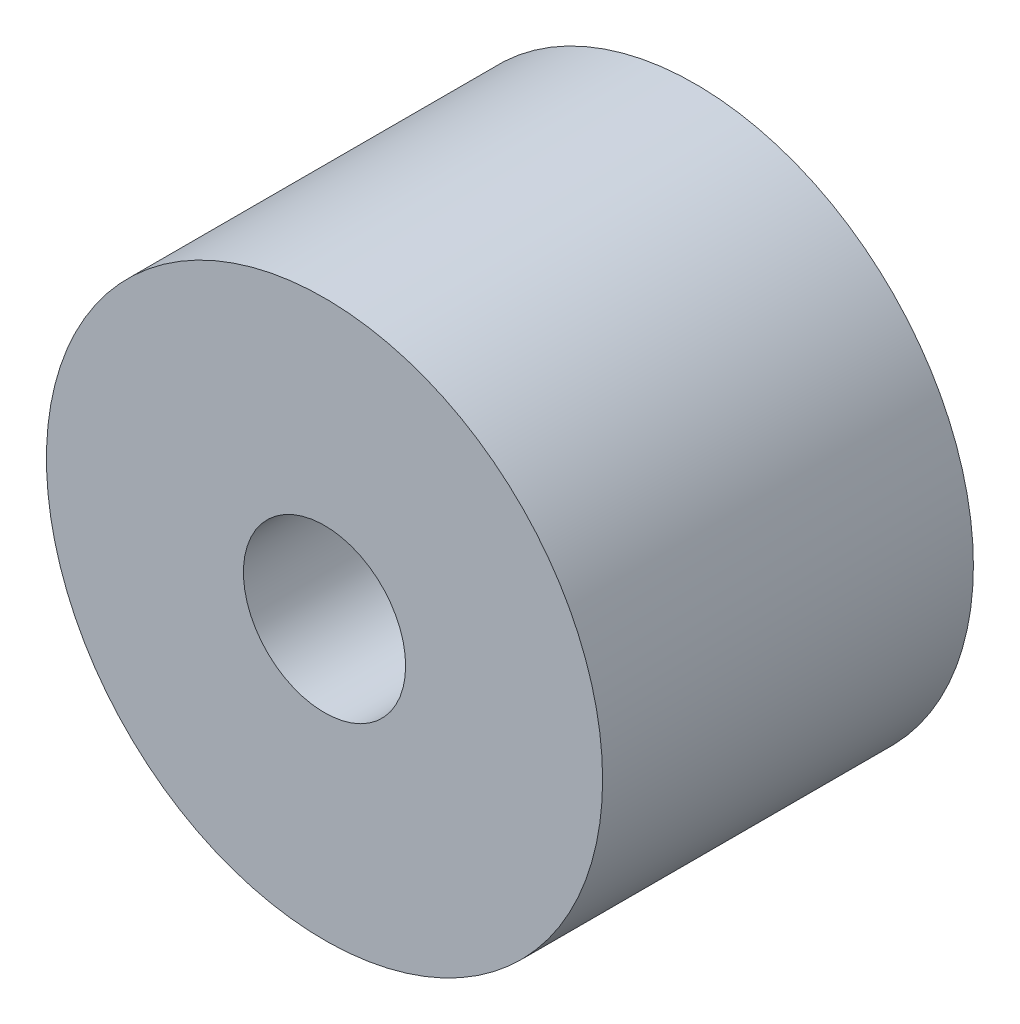
from build123d import *

# Parameters (mm, degrees)
CROQUIS1_R              = 19.05
CROQUIS1_R_2            = 5.55625
SALIENTE_EXTRUIR1_DEPTH = 12.7


with BuildPart() as part:
    # Croquis1 → Saliente-Extruir1 (new, symmetric)
    with BuildSketch(Plane.XY):
        Circle(CROQUIS1_R)
        Circle(CROQUIS1_R_2, mode=Mode.SUBTRACT)
    extrude(amount=SALIENTE_EXTRUIR1_DEPTH, both=True)


solid = part.part
